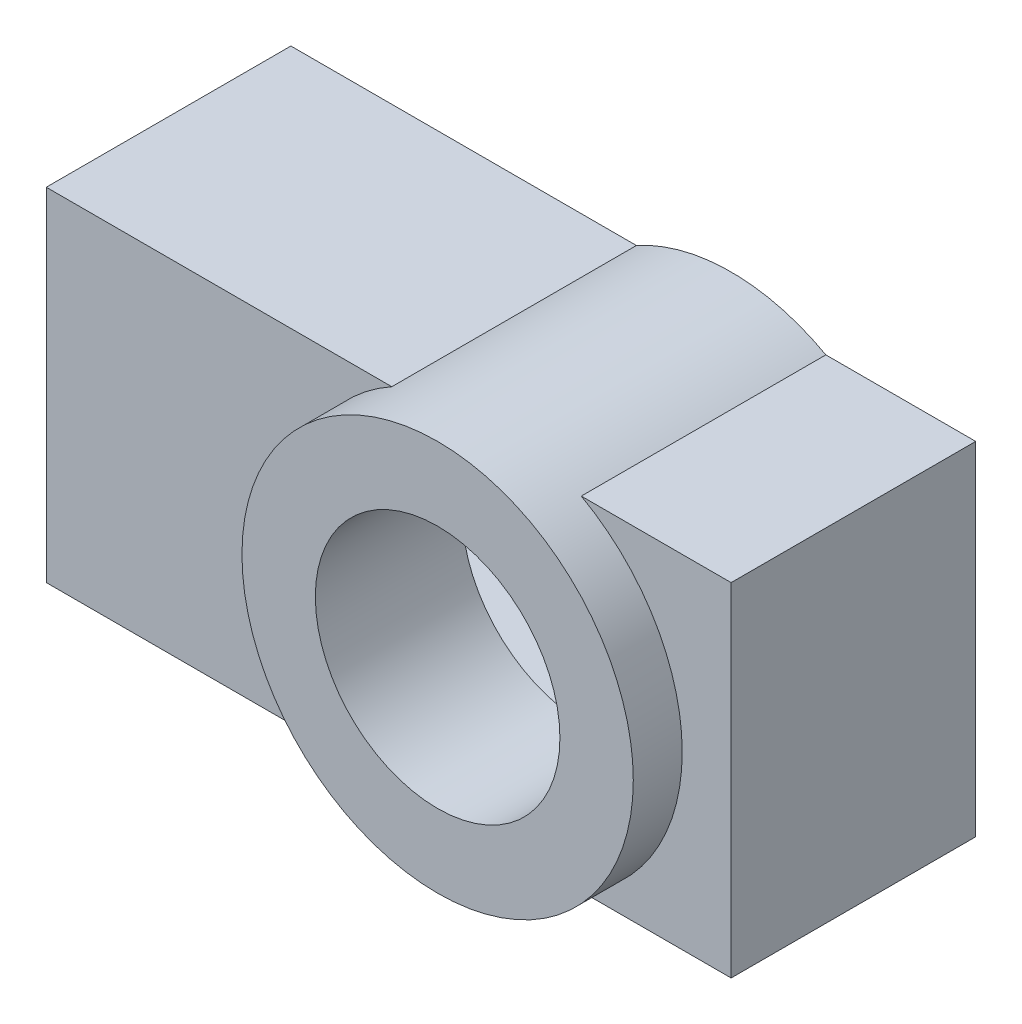
from build123d import *

# Parameters (mm, degrees)
SKETCH1_W                = 4
SKETCH1_H                = 7
SKETCH1_W_2              = 2
SKETCH1_H_2              = 5
SKETCH1_W_3              = 1
BOSS_EXTRUDE1_DEPTH      = 14
SKETCH2_R                = 2.5
CUT_EXTRUDE1_DEPTH       = 14
BOSS_EXTRUDE3_DEPTH      = 1
BOSS_EXTRUDE3_DEPTH_BACK = 5
SKETCH3_R                = 4
SKETCH3_R_2              = 2.5
SKETCH4_W                = 2
SKETCH4_H                = 5
CUT_EXTRUDE2_DEPTH       = 16.099668871
SKETCH6_W                = 5.975626827
SKETCH6_H                = 5.438491831
BOSS_EXTRUDE4_DEPTH      = 0.5
SKETCH7_W                = 2
SKETCH7_H                = 5
BOSS_EXTRUDE5_DEPTH      = 2


with BuildPart() as part:
    # Sketch1 → Boss-Extrude1 (new body)
    # profile 1 of 2: a face of its own
    with BuildSketch(Plane(origin=(0, 0, 0), x_dir=(0, 0, -1), z_dir=(1, 0, 0))):
        Rectangle(SKETCH1_W, SKETCH1_H)
        Rectangle(SKETCH1_W_2, SKETCH1_H_2, mode=Mode.SUBTRACT)
    # profile 2 of 2: a face of its own
    with BuildSketch(Plane(origin=(0, 0, 0), x_dir=(0, 0, -1), z_dir=(1, 0, 0))):
        with Locations((-2.5, 0)):
            Rectangle(SKETCH1_W_3, SKETCH1_H)
    extrude(amount=BOSS_EXTRUDE1_DEPTH)

    # Sketch2 → Cut-Extrude1 (cut)
    with BuildSketch(Plane.XY.offset(3)):
        with Locations((9, 0)):
            Circle(SKETCH2_R)
    extrude(amount=-CUT_EXTRUDE1_DEPTH, mode=Mode.SUBTRACT)

    # Sketch3 → Boss-Extrude3 (add, two sides: drawn at the far end of the back side and taken through both)
    with BuildSketch(Plane.XY.offset(3).offset(-BOSS_EXTRUDE3_DEPTH_BACK)):
        with Locations((9, 0)):
            Circle(SKETCH3_R)
        with Locations((9, 0)):
            Circle(SKETCH3_R_2, mode=Mode.SUBTRACT)
    extrude(amount=BOSS_EXTRUDE3_DEPTH + BOSS_EXTRUDE3_DEPTH_BACK)

    # Sketch4 → Cut-Extrude2 (cut, through all)
    with BuildSketch(Plane(origin=(14, 0, 0), x_dir=(0, 0, -1), z_dir=(1, 0, 0))):
        Rectangle(SKETCH4_W, SKETCH4_H)
    extrude(amount=-CUT_EXTRUDE2_DEPTH, mode=Mode.SUBTRACT)

    # Sketch6 → Boss-Extrude4 (add)
    with BuildSketch(Plane(origin=(0, 0, -2), x_dir=(-1, 0, 0), z_dir=(0, 0, -1))):
        with Locations((-9.038624366, 0.008392735)):
            Rectangle(SKETCH6_W, SKETCH6_H)
    extrude(amount=-BOSS_EXTRUDE4_DEPTH)

    # Sketch7 → Boss-Extrude5 (add)
    with BuildSketch(Plane(origin=(14, 0, 0), x_dir=(0, 0, -1), z_dir=(1, 0, 0))):
        Rectangle(SKETCH7_W, SKETCH7_H)
    extrude(amount=-BOSS_EXTRUDE5_DEPTH)


solid = part.part
